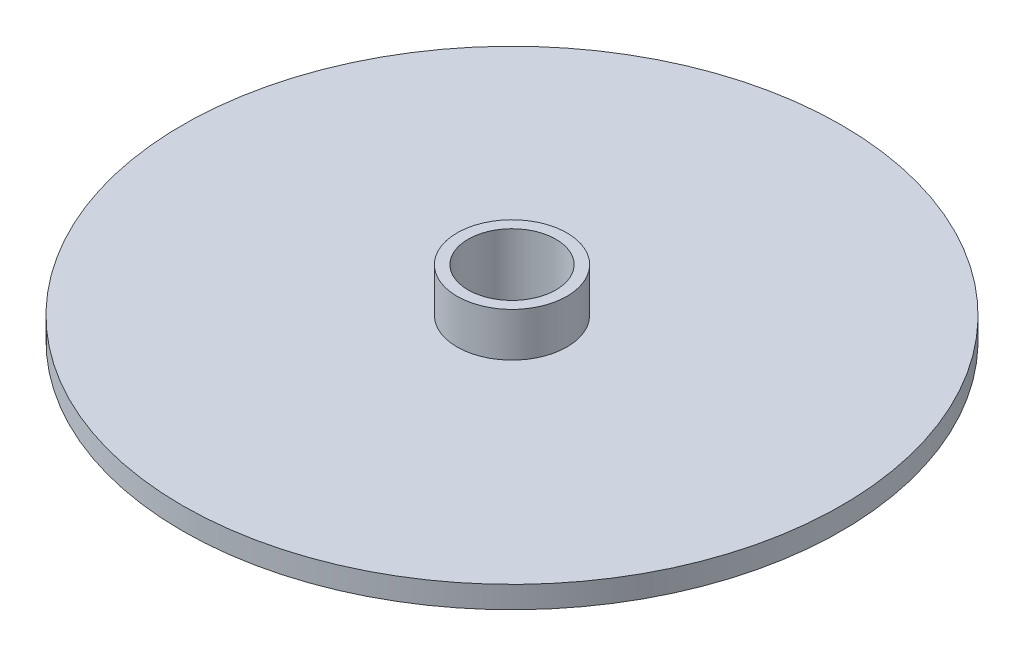
from build123d import *

# Parameters (mm, degrees)
SKETCH1_R           = 150
SKETCH1_R_2         = 25
SKETCH1_R_3         = 20
BOSS_EXTRUDE4_DEPTH = 10
SKETCH2_R           = 25
SKETCH2_R_2         = 20
BOSS_EXTRUDE6_DEPTH = 20


with BuildPart() as part:
    # Sketch1 → Boss-Extrude4 (new body)
    # profile 1 of 2: a face of its own
    with BuildSketch(Plane(origin=(0, 0, 0), x_dir=(1, 0, 0), z_dir=(0, 1, 0))):
        with Locations(Location((0, 0, 0), (0, 0, 270))):
            Circle(SKETCH1_R)
        Circle(SKETCH1_R_2, mode=Mode.SUBTRACT)
    # profile 2 of 2: a face of its own
    with BuildSketch(Plane(origin=(0, 0, 0), x_dir=(1, 0, 0), z_dir=(0, 1, 0))):
        Circle(SKETCH1_R_2)
        with Locations(Location((0, 0, 0), (0, 0, 270))):
            Circle(SKETCH1_R_3, mode=Mode.SUBTRACT)
    extrude(amount=BOSS_EXTRUDE4_DEPTH)

    # Sketch2 → Boss-Extrude6 (add)
    with BuildSketch(Plane(origin=(0, 10, 0), x_dir=(1, 0, 0), z_dir=(0, 1, 0))):
        with Locations(Location((0, 0, 0), (0, 0, 270))):
            Circle(SKETCH2_R)
        with Locations(Location((0, 0, 0), (0, 0, 270))):
            Circle(SKETCH2_R_2, mode=Mode.SUBTRACT)
    extrude(amount=BOSS_EXTRUDE6_DEPTH)


solid = part.part
